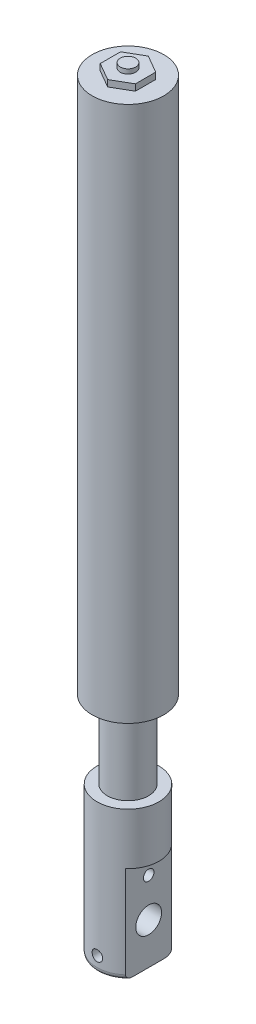
from build123d import *

# Parameters (mm, degrees)
SCHIZZO1_R                   = 6.93
ESTRUSIONE_ESTRUSIONE1_DEPTH = 103.85
ESTRUSIONE_ESTRUSIONE2_DEPTH = 1.24
SCHIZZO3_R                   = 1.495
ESTRUSIONE_ESTRUSIONE3_DEPTH = 0.88
SCHIZZO4_R                   = 3.995
ESTRUSIONE_ESTRUSIONE4_DEPTH = 15.04
SCHIZZO5_R                   = 6
ESTRUSIONE_ESTRUSIONE5_DEPTH = 28.8
TAGLIO_ESTRUSIONE1_START     = -18.82
TAGLIO_ESTRUSIONE1_DEPTH     = 18.82
SCHIZZO7_R                   = 2.5
TAGLIO_ESTRUSIONE2_DEPTH     = 107.758369227
FORO_FILETTATO_M2_5X0_45_1_D = 2.05
RACCORDO1_R                  = 1
FORO_FILETTATO_M2_5X0_45_2_D = 2.05
SCHIZZO12_R                  = 2.5
TAGLIO_ESTRUSIONE5_DEPTH     = 2.5


with BuildPart() as part:
    # Schizzo1 → Estrusione-Estrusione1 (new body)
    with BuildSketch(Plane(origin=(0, 0, 0), x_dir=(1, 0, 0), z_dir=(0, 1, 0))):
        with Locations(Location((0, 0, 0), (0, 0, 270))):
            Circle(SCHIZZO1_R)
    extrude(amount=ESTRUSIONE_ESTRUSIONE1_DEPTH)

    # Schizzo2 → Estrusione-Estrusione2 (add)
    with BuildSketch(Plane(origin=(0, 103.85, 0), x_dir=(1, 0, 0), z_dir=(0, 1, 0))):
        Polygon((-3.407809964, 1.9675), (-3.407809964, -1.9675), (0, -3.935), (3.407809964, -1.9675), (3.407809964, 1.9675), (0, 3.935), align=None)
    extrude(amount=ESTRUSIONE_ESTRUSIONE2_DEPTH)

    # Schizzo3 → Estrusione-Estrusione3 (add)
    with BuildSketch(Plane(origin=(0, 105.09, 0), x_dir=(1, 0, 0), z_dir=(0, 1, 0))):
        with Locations(Location((0, 0, 0), (0, 0, 270))):
            Circle(SCHIZZO3_R)
    extrude(amount=ESTRUSIONE_ESTRUSIONE3_DEPTH)

    # Schizzo4 → Estrusione-Estrusione4 (add)
    with BuildSketch(Plane(origin=(0, 0, 0), x_dir=(-1, 0, 0), z_dir=(0, -1, 0))):
        with Locations(Location((0, 0, 0), (0, 0, 270))):
            Circle(SCHIZZO4_R)
    extrude(amount=ESTRUSIONE_ESTRUSIONE4_DEPTH)

    # Schizzo5 → Estrusione-Estrusione5 (add)
    with BuildSketch(Plane.XZ.offset(15.04)):
        with Locations(Location((0, 0, 0), (0, 0, 270))):
            Circle(SCHIZZO5_R)
    extrude(amount=ESTRUSIONE_ESTRUSIONE5_DEPTH)

    # Schizzo6 → Taglio-Estrusione1 (cut)
    with BuildSketch(Plane.XZ.offset(43.84).offset(TAGLIO_ESTRUSIONE1_START)):
        with BuildLine():
            Line((-4.01, -4.463171518), (-4.01, 4.463171518))
            ThreePointArc((-4.01, 4.463171518), (-6, 0), (-4.01, -4.463171518))
        make_face()
        with BuildLine():
            ThreePointArc((6, 0), (5.479963504, 2.443358345), (4.01, 4.463171518))
            Line((4.01, 4.463171518), (4.01, -4.463171518))
            ThreePointArc((4.01, -4.463171518), (5.479963504, -2.443358345), (6, 0))
        make_face()
    extrude(amount=TAGLIO_ESTRUSIONE1_DEPTH, mode=Mode.SUBTRACT)

    # Schizzo7 → Taglio-Estrusione2 (cut, through all)
    with BuildSketch(Plane.ZY.offset(4.01)):
        with Locations((0, -35.84)):
            Circle(SCHIZZO7_R)
    extrude(amount=-TAGLIO_ESTRUSIONE2_DEPTH, mode=Mode.SUBTRACT)

    # Foro filettato M2.5x0.45-1 (through all)
    with Locations(Plane.ZY.offset(4.01)):
        with Locations((0, -28.34)):
            Hole(FORO_FILETTATO_M2_5X0_45_1_D / 2)

    # Raccordo1
    raccordo1_edges = [part.edges().sort_by_distance(p)[0] for p in [
        (2.1472041, -43.84, -5.602634608),
        (0, -43.84, 6),
    ]]
    fillet(raccordo1_edges, radius=RACCORDO1_R)

    # Foro filettato M2.5x0.45-2 (through all)
    with Locations(Plane(origin=(0, -40.84, 6), x_dir=(1, 0, 0), z_dir=(0, 0, 1))):
        with Locations((0, 0)):
            Hole(FORO_FILETTATO_M2_5X0_45_2_D / 2)

    # Schizzo12 → Taglio-Estrusione5 (cut)
    with BuildSketch(Plane.XY.offset(-6)):
        with Locations(Location((0, -40.84, 0), (0, 0, 233.130102354))):
            Circle(SCHIZZO12_R)
    extrude(amount=TAGLIO_ESTRUSIONE5_DEPTH, mode=Mode.SUBTRACT)


solid = part.part
